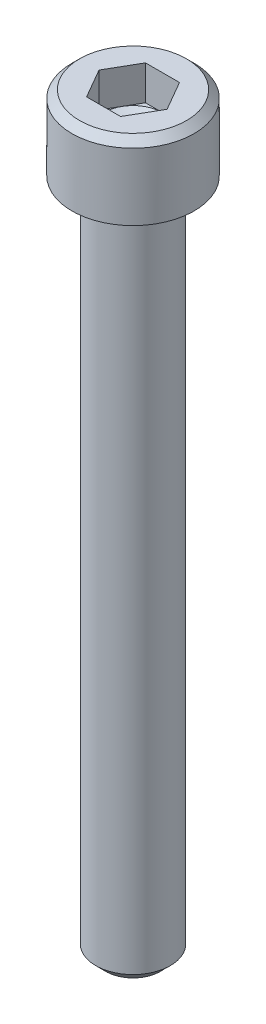
from build123d import *

# Parameters (mm, degrees)
SKETCH1_W           = 2.8702
SKETCH1_H           = 3.5052
SKETCH2_R           = 1.7526
BOSS_EXTRUDE1_DEPTH = 31.75
CUT_EXTRUDE1_DEPTH  = 1.6256
CHAMFER1_SIZE       = 0.47244
CHAMFER2_SIZE       = 0.3556
FILLET1_R           = 0.254


with BuildPart() as part:
    # Sketch1 → Revolve1 (revolve)
    with BuildSketch(Plane.XY, mode=Mode.PRIVATE) as revolve1_sk:
        with Locations((1.4351, 1.7526)):
            Rectangle(SKETCH1_W, SKETCH1_H)
    revolve(revolve1_sk.sketch.rotate(Axis((0, 3.5052, 0), (0, -1, 0)), 270), axis=Axis((0, 3.5052, 0), (0, -1, 0)))

    # Sketch2 → Boss-Extrude1 (add)
    with BuildSketch(Plane.XZ):
        with Locations(Location((0, 0, 0), (0, 0, 270))):
            Circle(SKETCH2_R)
    extrude(amount=BOSS_EXTRUDE1_DEPTH)

    # Sketch3 → Cut-Extrude1 (cut)
    with BuildSketch(Plane(origin=(0, 3.5052, 0), x_dir=(-1, 0, 0), z_dir=(0, 1, 0))):
        Polygon((-0.799225978, 1.3843), (-1.598451955, 0), (-0.799225978, -1.3843), (0.799225978, -1.3843), (1.598451955, 0), (0.799225978, 1.3843), align=None)
    extrude(amount=-CUT_EXTRUDE1_DEPTH, mode=Mode.SUBTRACT)

    # Sketch4 → Cut-Revolve1 (revolve, cut)
    with BuildSketch(Plane.XY, mode=Mode.PRIVATE) as cut_revolve1_sk:
        Polygon((1.3843, 1.8796), (0, 1.8796), (0, 1.080374022), align=None)
    revolve(cut_revolve1_sk.sketch.rotate(Axis((0, 1.879625, 0), (0, -1, 0)), 90), axis=Axis((0, 1.879625, 0), (0, -1, 0)), mode=Mode.SUBTRACT)

    # Chamfer1
    chamfer1_edges = [part.edges().sort_by_distance(p)[0] for p in [
        (0, -31.75, 1.7526),
    ]]
    chamfer(chamfer1_edges, length=CHAMFER1_SIZE)

    # Chamfer2
    chamfer2_edges = [part.edges().sort_by_distance(p)[0] for p in [
        (0, 3.5052, 2.8702),
    ]]
    chamfer(chamfer2_edges, length=CHAMFER2_SIZE)

    # Fillet1
    fillet1_edges = [part.edges().sort_by_distance(p)[0] for p in [
        (0, 0, 1.7526),
    ]]
    fillet(fillet1_edges, radius=FILLET1_R)


solid = part.part
